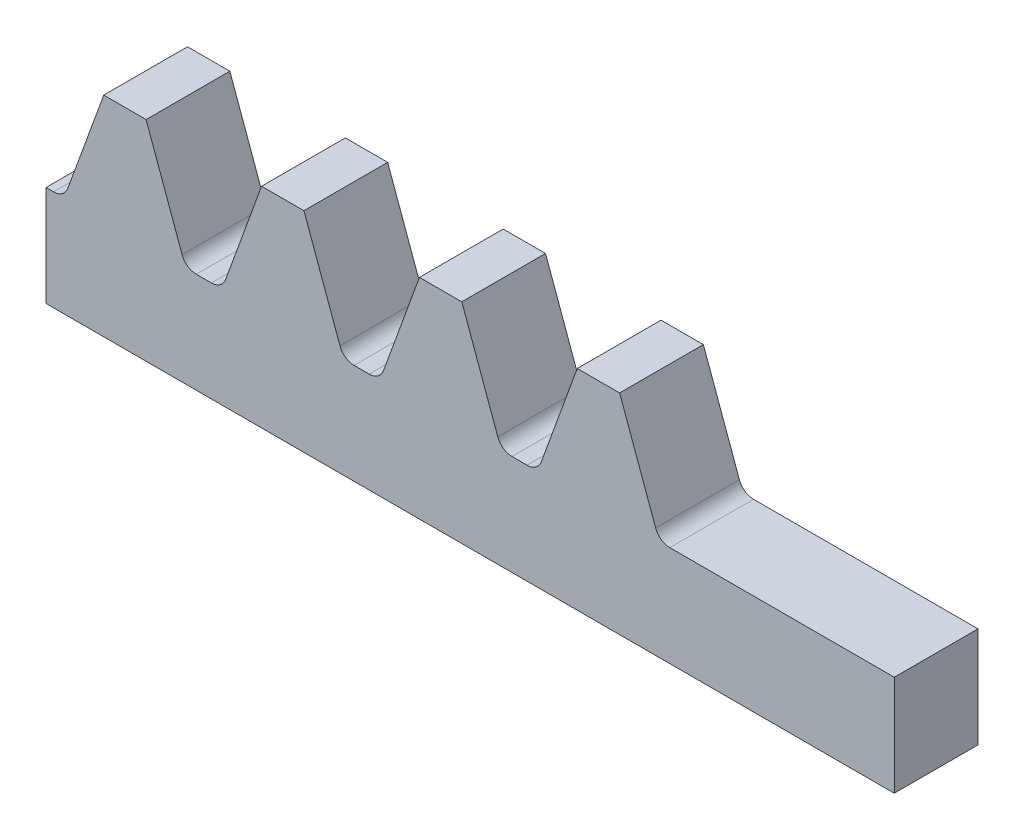
from build123d import *

# Parameters (mm, degrees)
BOSS_EXTRUDE1_DEPTH = 10


with BuildPart() as part:
    # Sketch1 → Boss-Extrude1 (new body)
    with BuildSketch(Plane.XY):
        with BuildLine():
            Line((138.578606851, 12), (138.578606851, 0))
            Line((138.578606851, 0), (37.275, 0))
            Line((37.275, 0), (37.275, 12))
            Line((37.275, 12), (38.178606851, 12))
            ThreePointArc((38.178606851, 12), (39.211044436, 12.32552632), (39.870053568, 13.184363742))
            Line((39.870053568, 13.184363742), (44.171321406, 25.002))
            Line((44.171321406, 25.002), (49.228678594, 25.002))
            Line((49.228678594, 25.002), (53.529946432, 13.184363742))
            ThreePointArc((53.529946432, 13.184363742), (54.188955564, 12.32552632), (55.221393149, 12))
            Line((55.221393149, 12), (57.028606851, 12))
            ThreePointArc((57.028606851, 12), (58.061044436, 12.32552632), (58.720053568, 13.184363742))
            Line((58.720053568, 13.184363742), (63.021321406, 25.002))
            Line((63.021321406, 25.002), (68.078678594, 25.002))
            Line((68.078678594, 25.002), (72.379946432, 13.184363742))
            ThreePointArc((72.379946432, 13.184363742), (73.038955564, 12.32552632), (74.071393149, 12))
            Line((74.071393149, 12), (75.878606851, 12))
            ThreePointArc((75.878606851, 12), (76.911044436, 12.32552632), (77.570053568, 13.184363742))
            Line((77.570053568, 13.184363742), (81.871321406, 25.002))
            Line((81.871321406, 25.002), (86.928678594, 25.002))
            Line((86.928678594, 25.002), (91.229946432, 13.184363742))
            ThreePointArc((91.229946432, 13.184363742), (91.888955564, 12.32552632), (92.921393149, 12))
            Line((92.921393149, 12), (94.728606851, 12))
            ThreePointArc((94.728606851, 12), (95.761044436, 12.32552632), (96.420053568, 13.184363742))
            Line((96.420053568, 13.184363742), (100.721321406, 25.002))
            Line((100.721321406, 25.002), (105.778678594, 25.002))
            Line((105.778678594, 25.002), (110.079946432, 13.184363742))
            ThreePointArc((110.079946432, 13.184363742), (110.738955564, 12.32552632), (111.771393149, 12))
            Line((111.771393149, 12), (113.578606851, 12))
            Line((113.578606851, 12), (138.578606851, 12))
        make_face()
    extrude(amount=BOSS_EXTRUDE1_DEPTH)


solid = part.part
